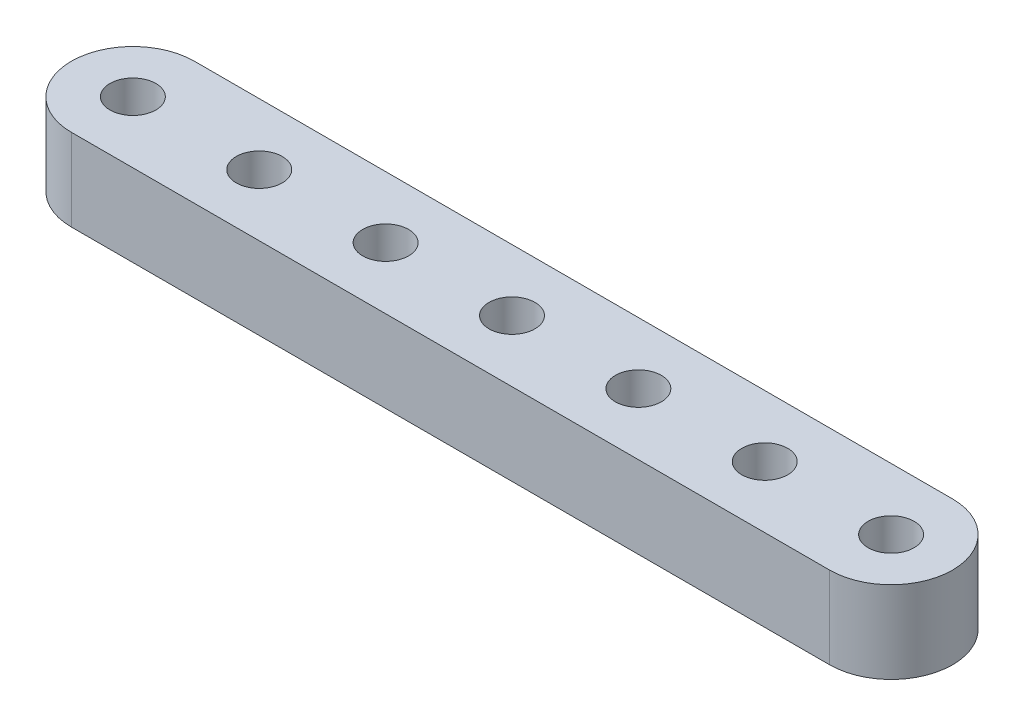
from build123d import *

# Parameters (mm, degrees)
SKETCH1_R           = 1.778
BOSS_EXTRUDE1_DEPTH = 6.35


with BuildPart() as part:
    # Sketch1 → Boss-Extrude1 (new body)
    with BuildSketch(Plane.XZ):
        with BuildLine():
            Line((-29.337, -4.7625), (29.337, -4.7625))
            ThreePointArc((29.337, -4.7625), (34.0995, 0), (29.337, 4.7625))
            Line((29.337, 4.7625), (-29.337, 4.7625))
            ThreePointArc((-29.337, 4.7625), (-34.0995, 0), (-29.337, -4.7625))
        make_face()
        with Locations(Location((29.337, 0, 0), (0, 0, 90))):
            Circle(SKETCH1_R, mode=Mode.SUBTRACT)
        with Locations(Location((19.558, 0, 0), (0, 0, 90))):
            Circle(SKETCH1_R, mode=Mode.SUBTRACT)
        with Locations(Location((9.779, 0, 0), (0, 0, 90))):
            Circle(SKETCH1_R, mode=Mode.SUBTRACT)
        with Locations(Location((0, 0, 0), (0, 0, 90))):
            Circle(SKETCH1_R, mode=Mode.SUBTRACT)
        with Locations(Location((-9.779, 0, 0), (0, 0, 90))):
            Circle(SKETCH1_R, mode=Mode.SUBTRACT)
        with Locations(Location((-19.558, 0, 0), (0, 0, 90))):
            Circle(SKETCH1_R, mode=Mode.SUBTRACT)
        with Locations(Location((-29.337, 0, 0), (0, 0, 90))):
            Circle(SKETCH1_R, mode=Mode.SUBTRACT)
    extrude(amount=-BOSS_EXTRUDE1_DEPTH)


solid = part.part
